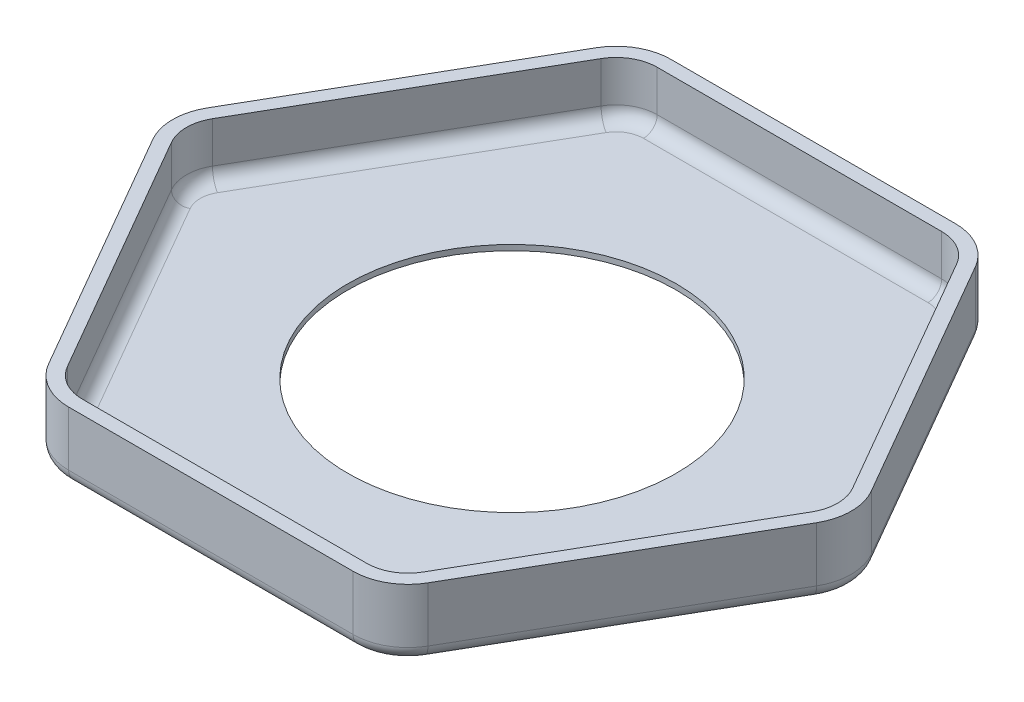
from build123d import *

# Parameters (mm, degrees)
SALIENTE_EXTRUIR2_DEPTH = 5
SALIENTE_EXTRUIR3_DEPTH = 20
REDONDEO2_R             = 5
REDONDEO3_R             = 5
CROQUIS4_R              = 60
CORTAR_EXTRUIR1_DEPTH   = 10
CROQUIS3_R              = 90
CORTAR_EXTRUIR2_DEPTH   = 3


with BuildPart() as part:
    # Croquis1 → Saliente-Extruir2 (new body)
    with BuildSketch(Plane(origin=(0, 0, 0), x_dir=(1, 0, 0), z_dir=(0, 1, 0))):
        with BuildLine():
            Line((-119.224191345, -9.394190445), (-67.262667118, -99.394190445))
            ThreePointArc((-67.262667118, -99.394190445), (-59.942159042, -106.71469852), (-49.942159042, -109.394190445))
            Line((-49.942159042, -109.394190445), (53.980889412, -109.394190445))
            ThreePointArc((53.980889412, -109.394190445), (63.980889412, -106.71469852), (71.301397487, -99.394190445))
            Line((71.301397487, -99.394190445), (123.262921714, -9.394190445))
            ThreePointArc((123.262921714, -9.394190445), (125.942413639, 0.605809555), (123.262921714, 10.605809555))
            Line((123.262921714, 10.605809555), (71.301397487, 100.605809555))
            ThreePointArc((71.301397487, 100.605809555), (63.980889412, 107.926317631), (53.980889412, 110.605809555))
            Line((53.980889412, 110.605809555), (-49.942159042, 110.605809555))
            ThreePointArc((-49.942159042, 110.605809555), (-59.942159042, 107.926317631), (-67.262667118, 100.605809555))
            Line((-67.262667118, 100.605809555), (-119.224191345, 10.605809555))
            ThreePointArc((-119.224191345, 10.605809555), (-121.90368327, 0.605809555), (-119.224191345, -9.394190445))
        make_face()
    extrude(amount=SALIENTE_EXTRUIR2_DEPTH)

    # Croquis2 → Saliente-Extruir3 (add)
    with BuildSketch(Plane(origin=(0, 5, 0), x_dir=(1, 0, 0), z_dir=(0, 1, 0))):
        with BuildLine():
            Line((-67.262667118, 100.605809555), (-119.224191345, 10.605809555))
            ThreePointArc((-119.224191345, 10.605809555), (-121.90368327, 0.605809555), (-119.224191345, -9.394190445))
            Line((-119.224191345, -9.394190445), (-67.262667118, -99.394190445))
            ThreePointArc((-67.262667118, -99.394190445), (-59.942159042, -106.71469852), (-49.942159042, -109.394190445))
            Line((-49.942159042, -109.394190445), (53.980889412, -109.394190445))
            ThreePointArc((53.980889412, -109.394190445), (63.980889412, -106.71469852), (71.301397487, -99.394190445))
            Line((71.301397487, -99.394190445), (123.262921714, -9.394190445))
            ThreePointArc((123.262921714, -9.394190445), (125.942413639, 0.605809555), (123.262921714, 10.605809555))
            Line((123.262921714, 10.605809555), (71.301397487, 100.605809555))
            ThreePointArc((71.301397487, 100.605809555), (63.980889412, 107.926317631), (53.980889412, 110.605809555))
            Line((53.980889412, 110.605809555), (-49.942159042, 110.605809555))
            ThreePointArc((-49.942159042, 110.605809555), (-59.942159042, 107.926317631), (-67.262667118, 100.605809555))
        make_face()
        with BuildLine():
            Line((-62.932540099, 98.105809555), (-114.894064326, 8.105809555))
            ThreePointArc((-114.894064326, 8.105809555), (-116.90368327, 0.605809555), (-114.894064326, -6.894190445))
            Line((-114.894064326, -6.894190445), (-62.932540099, -96.894190445))
            ThreePointArc((-62.932540099, -96.894190445), (-57.442159042, -102.384571501), (-49.942159042, -104.394190445))
            Line((-49.942159042, -104.394190445), (53.980889412, -104.394190445))
            ThreePointArc((53.980889412, -104.394190445), (61.480889412, -102.384571501), (66.971270468, -96.894190445))
            Line((66.971270468, -96.894190445), (118.932794695, -6.894190445))
            ThreePointArc((118.932794695, -6.894190445), (120.942413639, 0.605809555), (118.932794695, 8.105809555))
            Line((118.932794695, 8.105809555), (66.971270468, 98.105809555))
            ThreePointArc((66.971270468, 98.105809555), (61.480889412, 103.596190612), (53.980889412, 105.605809555))
            Line((53.980889412, 105.605809555), (-49.942159042, 105.605809555))
            ThreePointArc((-49.942159042, 105.605809555), (-57.442159042, 103.596190612), (-62.932540099, 98.105809555))
        make_face(mode=Mode.SUBTRACT)
    extrude(amount=SALIENTE_EXTRUIR3_DEPTH)

    # Redondeo2
    redondeo2_edges = [part.edges().sort_by_distance(p)[0] for p in [
        (2.019365185, 0, -110.605809555),
        (63.980889412, 0, -107.926317631),
        (97.282159601, 0, -55.605809555),
        (125.942413639, 0, -0.605809555),
        (97.282159601, 0, 54.394190445),
        (63.980889412, 0, 106.71469852),
        (2.019365185, 0, 109.394190445),
        (-59.942159042, 0, 106.71469852),
        (-93.243429232, 0, 54.394190445),
        (-121.90368327, 0, -0.605809555),
        (-93.243429232, 0, -55.605809555),
        (-59.942159042, 0, -107.926317631),
    ]]
    fillet(redondeo2_edges, radius=REDONDEO2_R)

    # Redondeo3
    redondeo3_edges = [part.edges().sort_by_distance(p)[0] for p in [
        (-57.442159042, 5, -103.596190612),
        (-88.913302213, 5, -53.105809555),
        (-116.90368327, 5, -0.605809555),
        (-88.913302213, 5, 51.894190445),
        (-57.442159042, 5, 102.384571501),
        (2.019365185, 5, 104.394190445),
        (61.480889412, 5, 102.384571501),
        (92.952032582, 5, 51.894190445),
        (120.942413639, 5, -0.605809555),
        (92.952032582, 5, -53.105809555),
        (61.480889412, 5, -103.596190612),
        (2.019365185, 5, -105.605809555),
    ]]
    fillet(redondeo3_edges, radius=REDONDEO3_R)

    # Croquis4 → Cortar-Extruir1 (cut)
    with BuildSketch(Plane(origin=(0, 0, 0), x_dir=(-1, 0, 0), z_dir=(0, -1, 0))):
        with Locations(Location((-2.019365185, 0.605809555, 0), (0, 0, 90))):
            Circle(CROQUIS4_R)
    extrude(amount=-CORTAR_EXTRUIR1_DEPTH, mode=Mode.SUBTRACT)

    # Croquis3 → Cortar-Extruir2 (cut)
    with BuildSketch(Plane.XZ):
        with Locations(Location((2.019365185, -0.605809555, 0), (0, 0, 270))):
            Circle(CROQUIS3_R)
    extrude(amount=-CORTAR_EXTRUIR2_DEPTH, mode=Mode.SUBTRACT)


solid = part.part
